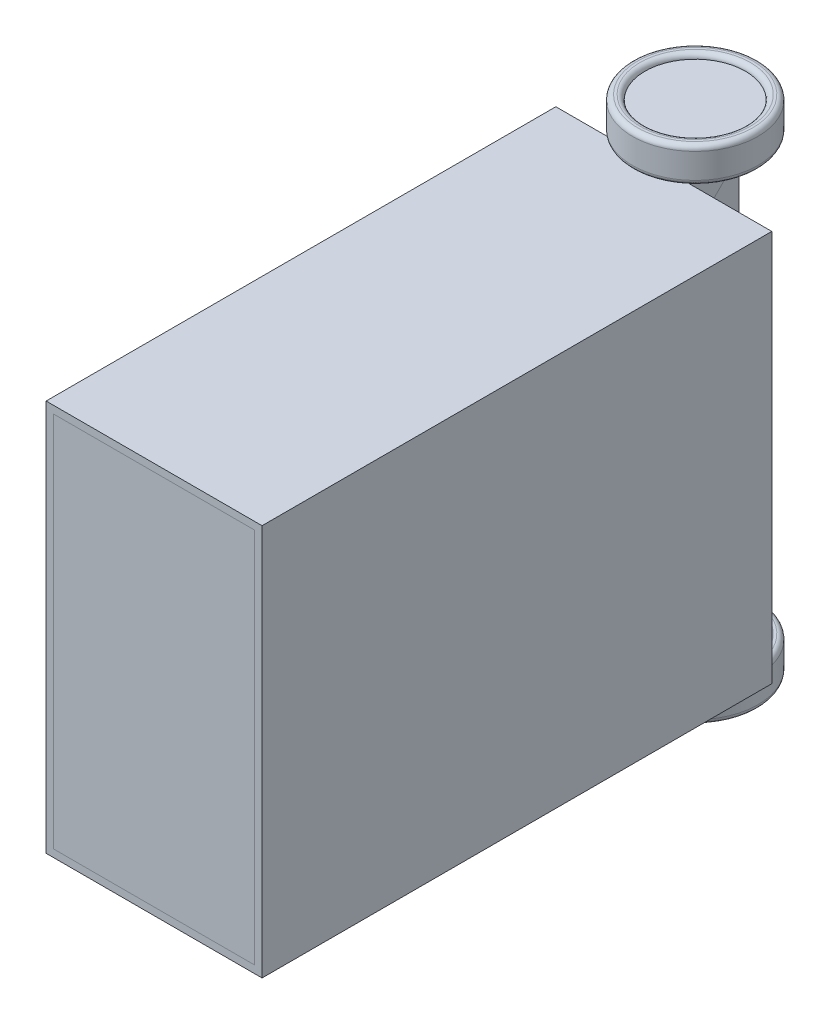
from build123d import *

# Parameters (mm, degrees)
SKIZZE1_W                         = 150
SKIZZE1_H                         = 80
AUFSATZ_LINEAR_AUSTRAGEN1_DEPTH   = 3
AUFSATZ_LINEAR_START              = -203
SKIZZE2_W                         = 86
SKIZZE2_H                         = 156
SKIZZE2_W_2                       = 80
SKIZZE2_H_2                       = 150
AUFSATZ_LINEAR_AUSTRAGEN2_DEPTH   = 203
SKIZZE3_W                         = 20
SKIZZE3_H                         = 20
AUFSATZ_LINEAR_AUSTRAGEN3_DEPTH   = 20
AUFSATZ_LINEAR_AUSTRAGEN3_2_DEPTH = 20
SKIZZE4_R                         = 4
AUFSATZ_LINEAR_AUSTRAGEN4_DEPTH   = 10
SKIZZE5_R                         = 20
AUFSATZ_LINEAR_AUSTRAGEN5_DEPTH   = 10
SKIZZE7_R                         = 25
SKIZZE7_R_2                       = 20
AUFSATZ_LINEAR_AUSTRAGEN6_DEPTH   = 7
VERRUNDUNG1_R                     = 2
AUFSATZ_LINEAR_START_2            = 5
SKIZZE8_W                         = 62.792128356
SKIZZE8_H                         = 131.806900062
AUFSATZ_LINEAR_AUSTRAGEN7_DEPTH   = 2
SKIZZE9_R                         = 8.508179415
AUFSATZ_LINEAR_AUSTRAGEN8_DEPTH   = 25
AUFSATZ_LINEAR_AUSTRAGEN8_2_DEPTH = 25
AUFSATZ_LINEAR_AUSTRAGEN8_3_DEPTH = 25


with BuildPart() as part:
    # Skizze1 → Aufsatz-Linear austragen1 (new body)
    with BuildSketch(Plane(origin=(0, 0, 0), x_dir=(0, 1, 0), z_dir=(0, 0, 1))):
        Rectangle(SKIZZE1_W, SKIZZE1_H)
    extrude(amount=AUFSATZ_LINEAR_AUSTRAGEN1_DEPTH)


with BuildPart() as body_2:
    # Körper-Verschieben/Kopieren1: copy of part
    add(part.part.moved(Location((0, 0, 40))))


with BuildPart() as body_3:
    # Körper-Verschieben/Kopieren2: copy of body 2
    add(body_2.part.moved(Location((0, 0, 100))))


with BuildPart() as body_4:
    # Körper-Verschieben/Kopieren3: copy of body 3
    add(body_3.part.moved(Location((0, 0, 30))))


with BuildPart() as body_5:
    # Körper-Verschieben/Kopieren4: copy of body 4
    add(body_4.part.moved(Location((0, 0, 30))))


with BuildPart() as body_6:
    # Skizze2 → Aufsatz-Linear austragen2 (new body)
    with BuildSketch(Plane(origin=(0, 0, 0), x_dir=(1, 0, 0), z_dir=(0, 0, -1)).offset(AUFSATZ_LINEAR_START)):
        Rectangle(SKIZZE2_W, SKIZZE2_H)
        Rectangle(SKIZZE2_W_2, SKIZZE2_H_2, mode=Mode.SUBTRACT)
    extrude(amount=AUFSATZ_LINEAR_AUSTRAGEN2_DEPTH)


with BuildPart() as body_7:
    # Skizze3 → Aufsatz-Linear austragen3 (new body)
    with BuildSketch(Plane(origin=(0, 0, 0), x_dir=(1, 0, 0), z_dir=(0, 0, -1))):
        with Locations((0, 68)):
            Rectangle(SKIZZE3_W, SKIZZE3_H)
    extrude(amount=AUFSATZ_LINEAR_AUSTRAGEN3_DEPTH)


with BuildPart() as body_8:
    # Skizze3 → Aufsatz-Linear austragen3 2 (new body)
    with BuildSketch(Plane(origin=(0, 0, 0), x_dir=(1, 0, 0), z_dir=(0, 0, -1))):
        with Locations((0, -68)):
            Rectangle(SKIZZE3_W, SKIZZE3_H)
    extrude(amount=AUFSATZ_LINEAR_AUSTRAGEN3_2_DEPTH)


with BuildPart() as body_9:
    # Skizze4 → Aufsatz-Linear austragen4 (new body)
    with BuildSketch(Plane.XZ.offset(78)):
        with Locations(Location((2.5, -10, 0), (0, 0, 270))):
            Circle(SKIZZE4_R)
    extrude(amount=AUFSATZ_LINEAR_AUSTRAGEN4_DEPTH)


with BuildPart() as body_10:
    # Skizze5 → Aufsatz-Linear austragen5 (new body)
    with BuildSketch(Plane.XZ.offset(88)):
        with Locations(Location((2.5, -10, 0), (0, 0, 270))):
            Circle(SKIZZE5_R)
    extrude(amount=AUFSATZ_LINEAR_AUSTRAGEN5_DEPTH)


with BuildPart() as body_11:
    # Skizze7 → Aufsatz-Linear austragen6 (new, symmetric)
    with BuildSketch(Plane(origin=(0, -93, 0), x_dir=(-1, 0, 0), z_dir=(0, -1, 0))):
        with Locations(Location((-2.5, 10, 0), (0, 0, 90))):
            Circle(SKIZZE7_R)
        with Locations(Location((-2.5, 10, 0), (0, 0, 90))):
            Circle(SKIZZE7_R_2, mode=Mode.SUBTRACT)
    extrude(amount=AUFSATZ_LINEAR_AUSTRAGEN6_DEPTH, both=True)

    # Verrundung1
    verrundung1_edges = [body_11.edges().sort_by_distance(p)[0] for p in [
        (2.5, -86, 15),
        (2.5, -100, 15),
        (2.5, -86, 10),
        (2.5, -100, 10),
    ]]
    fillet(verrundung1_edges, radius=VERRUNDUNG1_R)


with BuildPart() as body_12:
    # Spiegeln1: mirrored copy
    add(body_7.part.mirror(Plane.ZX))


with BuildPart() as body_13:
    # Spiegeln1 2: mirrored copy
    add(body_9.part.mirror(Plane.ZX))


with BuildPart() as body_14:
    # Spiegeln1 3: mirrored copy
    add(body_11.part.mirror(Plane.ZX))


with BuildPart() as body_15:
    # Spiegeln1 4: mirrored copy
    add(body_10.part.mirror(Plane.ZX))


with BuildPart() as body_16:
    # Skizze8 → Aufsatz-Linear austragen7 (new body)
    with BuildSketch(Plane.XY.offset(43).offset(AUFSATZ_LINEAR_START_2)):
        Rectangle(SKIZZE8_W, SKIZZE8_H)
    extrude(amount=AUFSATZ_LINEAR_AUSTRAGEN7_DEPTH)


with BuildPart() as body_17:
    # Skizze9 → Aufsatz-Linear austragen8 (new, symmetric)
    with BuildSketch(Plane.YZ):
        with Locations(Location((-22.600031485, 186.213003452, 0), (0, 0, 270))):
            Circle(SKIZZE9_R)
    extrude(amount=AUFSATZ_LINEAR_AUSTRAGEN8_DEPTH, both=True)


with BuildPart() as body_18:
    # Skizze9 → Aufsatz-Linear austragen8 2 (new, symmetric)
    with BuildSketch(Plane.YZ):
        with Locations(Location((-5.583672655, 186.213003452, 0), (0, 0, 270))):
            Circle(SKIZZE9_R)
    extrude(amount=AUFSATZ_LINEAR_AUSTRAGEN8_2_DEPTH, both=True)


with BuildPart() as body_19:
    # Skizze9 → Aufsatz-Linear austragen8 3 (new, symmetric)
    with BuildSketch(Plane.YZ):
        with Locations(Location((11.432686175, 186.213003452, 0), (0, 0, 270))):
            Circle(SKIZZE9_R)
    extrude(amount=AUFSATZ_LINEAR_AUSTRAGEN8_3_DEPTH, both=True)


solid = Compound([part.part, body_2.part, body_3.part, body_4.part, body_5.part, body_6.part, body_7.part, body_8.part, body_9.part, body_10.part, body_11.part, body_12.part, body_13.part, body_14.part, body_15.part, body_16.part, body_17.part, body_18.part, body_19.part])
